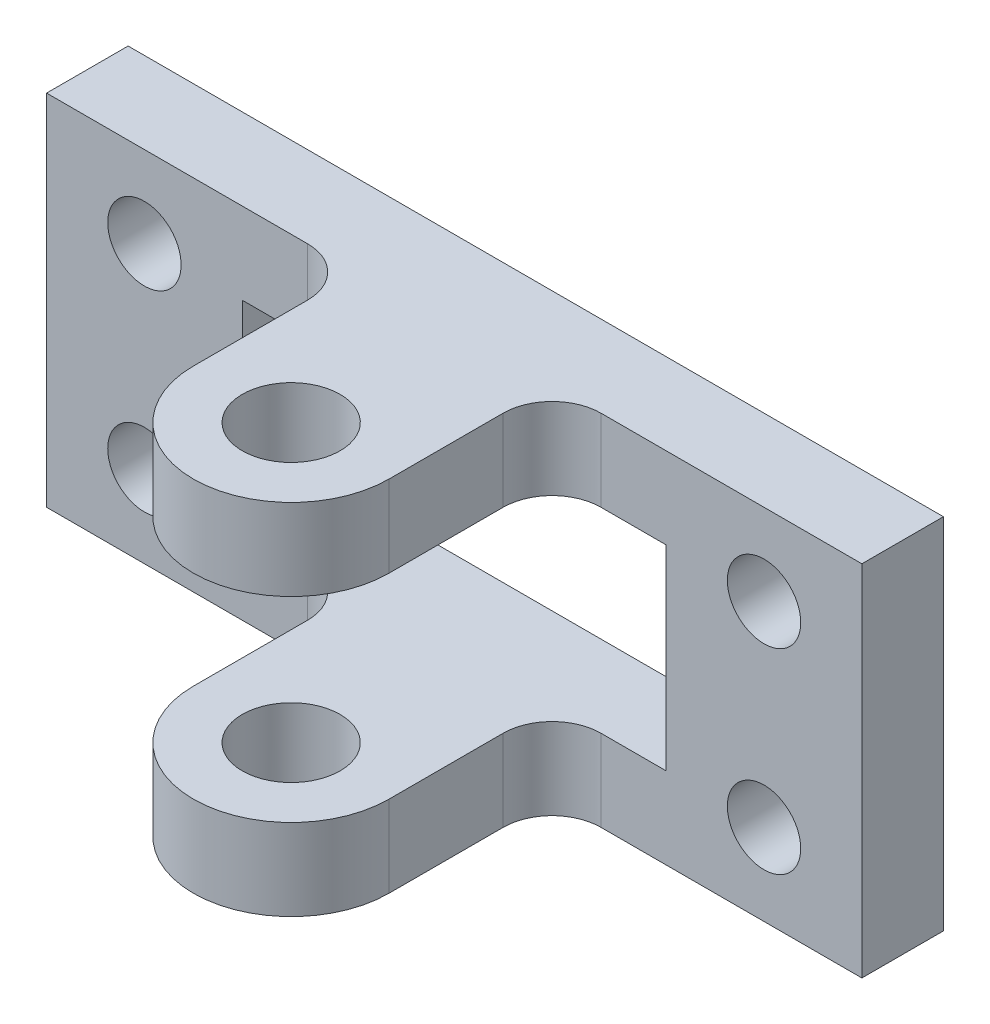
from build123d import *

# Parameters (mm, degrees)
SKETCH_1_W                = 6
SKETCH_1_H                = 5
REVOLVE_1_ANGLE           = 180
SKETCH_2_W                = 12
SKETCH_2_H                = 5
EXTRUDE_1_DEPTH           = 15
SKETCH_3_W                = 5
SKETCH_3_H                = 5
EXTRUDE_2_DEPTH           = 19
SKETCH_4_W                = 5
SKETCH_4_H                = 5
EXTRUDE_3_DEPTH           = 19
SKETCH_5_W                = 12
SKETCH_5_H                = 5
EXTRUDE_4_DEPTH           = 12
SKETCH_6_W                = 12
SKETCH_6_H                = 5
EXTRUDE_5_DEPTH           = 12
EXTRUDE_START             = 5
EXTRUDE_6_DEPTH           = 5
HOLE_WIZARD_6_0_6_1_D     = 6
HOLE_WIZARD_6_0_6_1_DEPTH = 5
HOLE_WIZARD_6_0_6_2_D     = 6
HOLE_WIZARD_6_0_6_2_DEPTH = 22
HOLE_WIZARD_4_5_4_5_1_D   = 4.5
FILLET_1_R                = 3


with BuildPart() as part:
    # 草图1 → 旋转1 (revolve)
    with BuildSketch(Plane(origin=(0, 0, 15), x_dir=(-1, 0, 0), z_dir=(0, 0, -1))):
        with Locations((3, -8.5)):
            Rectangle(SKETCH_1_W, SKETCH_1_H)
    revolve(axis=Axis((0, -6, 15), (0, 1, 0)), revolution_arc=REVOLVE_1_ANGLE)

    # 草图2 → 凸台-拉伸1 (add)
    with BuildSketch(Plane(origin=(0, 0, 15), x_dir=(-1, 0, 0), z_dir=(0, 0, -1))):
        with Locations((0, -8.5)):
            Rectangle(SKETCH_2_W, SKETCH_2_H)
    extrude(amount=EXTRUDE_1_DEPTH)

    # 草图3 → 凸台-拉伸2 (add)
    with BuildSketch(Plane.ZY.offset(6)):
        with Locations((2.5, -8.5)):
            Rectangle(SKETCH_3_W, SKETCH_3_H)
    extrude(amount=EXTRUDE_2_DEPTH)

    # 草图4 → 凸台-拉伸3 (add)
    with BuildSketch(Plane(origin=(6, 0, 0), x_dir=(0, 0, -1), z_dir=(1, 0, 0))):
        with Locations((-2.5, -8.5)):
            Rectangle(SKETCH_4_W, SKETCH_4_H)
    extrude(amount=EXTRUDE_3_DEPTH)

    # 草图5 → 凸台-拉伸4 (add)
    with BuildSketch(Plane(origin=(0, -6, 0), x_dir=(-1, 0, 0), z_dir=(0, 1, 0))):
        with Locations((-19, 2.5)):
            Rectangle(SKETCH_5_W, SKETCH_5_H)
    extrude(amount=EXTRUDE_4_DEPTH)

    # 草图6 → 凸台-拉伸5 (add)
    with BuildSketch(Plane(origin=(0, -6, 0), x_dir=(-1, 0, 0), z_dir=(0, 1, 0))):
        with Locations((19, 2.5)):
            Rectangle(SKETCH_6_W, SKETCH_6_H)
    extrude(amount=EXTRUDE_5_DEPTH)

    # 草图7 → 凸台-拉伸6 (add)
    with BuildSketch(Plane(origin=(0, 6, 0), x_dir=(-1, 0, 0), z_dir=(0, 1, 0)).offset(EXTRUDE_START)):
        with BuildLine():
            Line((25, 5), (25, 0))
            Line((25, 0), (-25, 0))
            Line((-25, 0), (-25, 5))
            Line((-25, 5), (-6, 5))
            Line((-6, 5), (-6, 15))
            ThreePointArc((-6, 15), (0, 21), (6, 15))
            Line((6, 15), (6, 5))
            Line((6, 5), (25, 5))
        make_face()
    extrude(amount=-EXTRUDE_6_DEPTH)

    # Ø6.0 (6) 直径孔1
    with Locations(Plane(origin=(0, 6, 0), x_dir=(-1, 0, 0), z_dir=(0, -1, 0))):
        with Locations((0, -15)):
            Hole(HOLE_WIZARD_6_0_6_1_D / 2, depth=HOLE_WIZARD_6_0_6_1_DEPTH)

    # Ø6.0 (6) 直径孔2
    with Locations(Plane(origin=(0, -11, 0), x_dir=(-1, 0, 0), z_dir=(0, -1, 0))):
        with Locations((0, -15)):
            Hole(HOLE_WIZARD_6_0_6_2_D / 2, depth=HOLE_WIZARD_6_0_6_2_DEPTH)

    # Ø4.5 (4.5) 直径孔1 (through all)
    with Locations(Plane(origin=(0, 0, 0), x_dir=(-1, 0, 0), z_dir=(0, 0, -1))):
        with Locations((-19, -6), (19, 6), (19, -6), (-19, 6)):
            Hole(HOLE_WIZARD_4_5_4_5_1_D / 2)

    # 圆角1
    fillet_1_edges = [part.edges().sort_by_distance(p)[0] for p in [
        (-6, -8.5, 5),
        (6, -8.5, 5),
        (-6, 8.5, 5),
        (6, 8.5, 5),
    ]]
    fillet(fillet_1_edges, radius=FILLET_1_R)


solid = part.part
